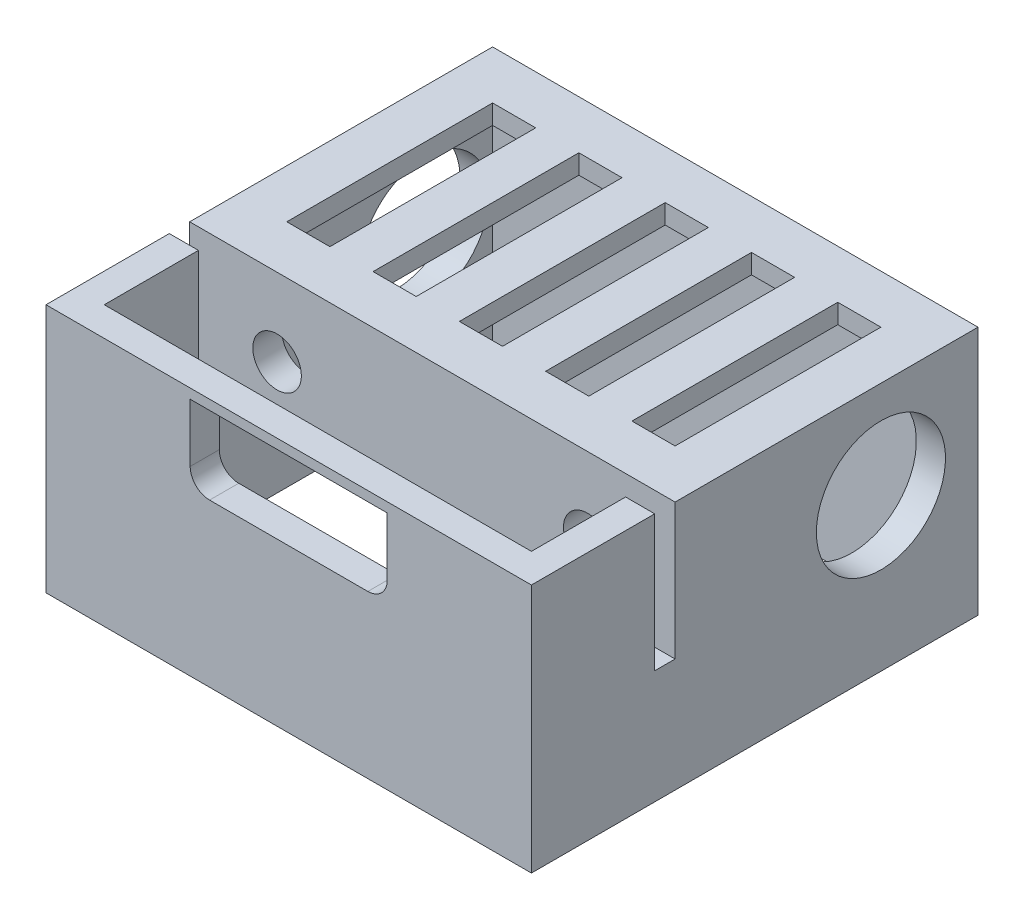
from build123d import *

# Parameters (mm, degrees)
CROQUIS1_W              = 50
CROQUIS1_H              = 46
CROQUIS1_W_2            = 44
CROQUIS1_H_2            = 40
SALIENTE_EXTRUIR1_DEPTH = 15
CROQUIS4_W              = 44
CROQUIS4_H              = 3
SALIENTE_EXTRUIR3_DEPTH = 10.7
CORTAR_EXTRUIR1_REACH   = 72.608
CROQUIS7_W              = 3
CROQUIS7_H              = 10.7
SALIENTE_EXTRUIR4_DEPTH = 10.7
SALIENTE_EXTRUIR5_DEPTH = 10.7
CORTAR_EXTRUIR2_REACH   = 72.778
CROQUIS9_R              = 6.65
CORTAR_EXTRUIR3_REACH   = 70.691
CROQUIS10_R             = 6.65
CROQUIS11_W             = 50
CROQUIS11_H             = 31.2
SALIENTE_EXTRUIR6_DEPTH = 2
CROQUIS12_W             = 3
CROQUIS12_H             = 12
SALIENTE_EXTRUIR7_DEPTH = 44
CORTAR_EXTRUIR4_REACH   = 62.537
CROQUIS13_R             = 2.5
REDONDEO1_R             = 2
CROQUIS15_W             = 2
CROQUIS15_H             = 10.7
SALIENTE_EXTRUIR8_DEPTH = 3
CROQUIS16_W             = 2.1
CROQUIS16_H             = 3.3
CORTAR_EXTRUIR5_DEPTH   = 50
CROQUIS17_W             = 2
CROQUIS17_H             = 10.7
SALIENTE_EXTRUIR9_DEPTH = 3
CORTAR_EXTRUIR6_REACH   = 69.968
CROQUIS18_W             = 4.444444444
CROQUIS18_H             = 21.2


with BuildPart() as part:
    # Croquis1 → Saliente-Extruir1 (new body)
    with BuildSketch(Plane(origin=(0, 0, 0), x_dir=(1, 0, 0), z_dir=(0, 1, 0))):
        with Locations((-22, -20)):
            Rectangle(CROQUIS1_W, CROQUIS1_H)
        with Locations((-22, -20)):
            Rectangle(CROQUIS1_W_2, CROQUIS1_H_2, mode=Mode.SUBTRACT)
    extrude(amount=SALIENTE_EXTRUIR1_DEPTH)

    # Croquis4 → Saliente-Extruir3 (add)
    with BuildSketch(Plane(origin=(0, 15, 0), x_dir=(1, 0, 0), z_dir=(0, 1, 0))):
        with Locations((-22, -41.5)):
            Rectangle(CROQUIS4_W, CROQUIS4_H)
    extrude(amount=SALIENTE_EXTRUIR3_DEPTH)

    # Croquis6 → Cortar-Extruir1 (cut, up to next)
    with BuildSketch(Plane.XY.offset(43), mode=Mode.PRIVATE) as cortar_extruir1_sk1:
        Polygon((-22, 24.7), (-11.85, 24.7), (-11.85, 16.7), (-32.15, 16.7), (-32.15, 24.7), align=None)
    cortar_extruir1_tool1 = extrude(cortar_extruir1_sk1.sketch, amount=-CORTAR_EXTRUIR1_REACH, mode=Mode.PRIVATE) & part.part
    add(cortar_extruir1_tool1.solids().sort_by_distance((-22, 20.7, 43))[0], mode=Mode.SUBTRACT)

    # Croquis7 → Saliente-Extruir4 (add)
    with BuildSketch(Plane.XY.offset(43)):
        with Locations((-45.5, 20.35)):
            Rectangle(CROQUIS7_W, CROQUIS7_H)
        with Locations((1.5, 20.35)):
            Rectangle(CROQUIS7_W, CROQUIS7_H)
    extrude(amount=-SALIENTE_EXTRUIR4_DEPTH)

    # Croquis8 → Saliente-Extruir5 (add)
    with BuildSketch(Plane(origin=(0, 15, 0), x_dir=(1, 0, 0), z_dir=(0, 1, 0))):
        Polygon((-47, -28.2), (-44, -28.2), (-44, 0), (0, 0), (0, -28.2), (3, -28.2), (3, 3), (-47, 3), align=None)
    extrude(amount=SALIENTE_EXTRUIR5_DEPTH)

    # Croquis9 → Cortar-Extruir2 (cut, up to next)
    with BuildSketch(Plane.ZY.offset(47), mode=Mode.PRIVATE) as cortar_extruir2_sk1:
        with Locations((7, 15.7)):
            Circle(CROQUIS9_R)
    cortar_extruir2_tool1 = extrude(cortar_extruir2_sk1.sketch, amount=-CORTAR_EXTRUIR2_REACH, mode=Mode.PRIVATE) & part.part
    add(cortar_extruir2_tool1.solids().sort_by_distance((-47, 15.7, 7))[0], mode=Mode.SUBTRACT)

    # Croquis10 → Cortar-Extruir3 (cut, up to next)
    with BuildSketch(Plane.ZY, mode=Mode.PRIVATE) as cortar_extruir3_sk1:
        with Locations((7, 15.7)):
            Circle(CROQUIS10_R)
    cortar_extruir3_tool1 = extrude(cortar_extruir3_sk1.sketch, amount=-CORTAR_EXTRUIR3_REACH, mode=Mode.PRIVATE) & part.part
    add(cortar_extruir3_tool1.solids().sort_by_distance((0, 15.7, 7))[0], mode=Mode.SUBTRACT)

    # Croquis11 → Saliente-Extruir6 (add)
    with BuildSketch(Plane(origin=(0, 25.7, 0), x_dir=(1, 0, 0), z_dir=(0, 1, 0))):
        with Locations((-22, -12.6)):
            Rectangle(CROQUIS11_W, CROQUIS11_H)
    extrude(amount=-SALIENTE_EXTRUIR6_DEPTH)

    # Croquis12 → Saliente-Extruir7 (add)
    with BuildSketch(Plane.ZY):
        with Locations((26.7, 17.7)):
            Rectangle(CROQUIS12_W, CROQUIS12_H)
    extrude(amount=SALIENTE_EXTRUIR7_DEPTH)

    # Croquis13 → Cortar-Extruir4 (cut, up to next)
    with BuildSketch(Plane(origin=(0, 0, 25.2), x_dir=(-1, 0, 0), z_dir=(0, 0, -1)), mode=Mode.PRIVATE) as cortar_extruir4_sk1:
        with Locations((6, 17.7)):
            Circle(CROQUIS13_R)
    cortar_extruir4_tool1 = extrude(cortar_extruir4_sk1.sketch, amount=-CORTAR_EXTRUIR4_REACH, mode=Mode.PRIVATE) & part.part
    # Croquis13 → Cortar-Extruir4 (cut, up to next)
    with BuildSketch(Plane(origin=(0, 0, 25.2), x_dir=(-1, 0, 0), z_dir=(0, 0, -1)), mode=Mode.PRIVATE) as cortar_extruir4_sk2:
        with Locations((38, 17.7)):
            Circle(CROQUIS13_R)
    cortar_extruir4_tool2 = extrude(cortar_extruir4_sk2.sketch, amount=-CORTAR_EXTRUIR4_REACH, mode=Mode.PRIVATE) & part.part
    add(cortar_extruir4_tool1.solids().sort_by_distance((-6, 17.7, 25.2))[0], mode=Mode.SUBTRACT)
    add(cortar_extruir4_tool2.solids().sort_by_distance((-38, 17.7, 25.2))[0], mode=Mode.SUBTRACT)

    # Redondeo1
    redondeo1_edges = [part.edges().sort_by_distance(p)[0] for p in [
        (-11.85, 16.7, 41.5),
        (-32.15, 16.7, 41.5),
    ]]
    fillet(redondeo1_edges, radius=REDONDEO1_R)

    # Croquis15 → Saliente-Extruir8 (add)
    with BuildSketch(Plane.ZY.offset(47)):
        with Locations((31.3, 20.35)):
            Rectangle(CROQUIS15_W, CROQUIS15_H)
    extrude(amount=-SALIENTE_EXTRUIR8_DEPTH)

    # Croquis16 → Cortar-Extruir5 (cut)
    with BuildSketch(Plane.ZY.offset(47)):
        with Locations((29.25, 13.35)):
            Rectangle(CROQUIS16_W, CROQUIS16_H)
    extrude(amount=-CORTAR_EXTRUIR5_DEPTH, mode=Mode.SUBTRACT)

    # Croquis17 → Saliente-Extruir9 (add)
    with BuildSketch(Plane(origin=(3, 0, 0), x_dir=(0, 0, -1), z_dir=(1, 0, 0))):
        with Locations((-31.3, 20.35)):
            Rectangle(CROQUIS17_W, CROQUIS17_H)
    extrude(amount=-SALIENTE_EXTRUIR9_DEPTH)

    # Croquis18 → Cortar-Extruir6 (cut, up to next)
    with BuildSketch(Plane.XZ.offset(-23.7), mode=Mode.PRIVATE) as cortar_extruir6_sk1:
        with Locations((-39.777777778, 12.6)):
            Rectangle(CROQUIS18_W, CROQUIS18_H)
    cortar_extruir6_tool1 = extrude(cortar_extruir6_sk1.sketch, amount=-CORTAR_EXTRUIR6_REACH, mode=Mode.PRIVATE) & part.part
    # Croquis18 → Cortar-Extruir6 (cut, up to next)
    with BuildSketch(Plane.XZ.offset(-23.7), mode=Mode.PRIVATE) as cortar_extruir6_sk2:
        with Locations((-30.888888889, 12.6)):
            Rectangle(CROQUIS18_W, CROQUIS18_H)
    cortar_extruir6_tool2 = extrude(cortar_extruir6_sk2.sketch, amount=-CORTAR_EXTRUIR6_REACH, mode=Mode.PRIVATE) & part.part
    # Croquis18 → Cortar-Extruir6 (cut, up to next)
    with BuildSketch(Plane.XZ.offset(-23.7), mode=Mode.PRIVATE) as cortar_extruir6_sk3:
        with Locations((-22, 12.6)):
            Rectangle(CROQUIS18_W, CROQUIS18_H)
    cortar_extruir6_tool3 = extrude(cortar_extruir6_sk3.sketch, amount=-CORTAR_EXTRUIR6_REACH, mode=Mode.PRIVATE) & part.part
    # Croquis18 → Cortar-Extruir6 (cut, up to next)
    with BuildSketch(Plane.XZ.offset(-23.7), mode=Mode.PRIVATE) as cortar_extruir6_sk4:
        with Locations((-13.111111111, 12.6)):
            Rectangle(CROQUIS18_W, CROQUIS18_H)
    cortar_extruir6_tool4 = extrude(cortar_extruir6_sk4.sketch, amount=-CORTAR_EXTRUIR6_REACH, mode=Mode.PRIVATE) & part.part
    # Croquis18 → Cortar-Extruir6 (cut, up to next)
    with BuildSketch(Plane.XZ.offset(-23.7), mode=Mode.PRIVATE) as cortar_extruir6_sk5:
        with Locations((-4.222222222, 12.6)):
            Rectangle(CROQUIS18_W, CROQUIS18_H)
    cortar_extruir6_tool5 = extrude(cortar_extruir6_sk5.sketch, amount=-CORTAR_EXTRUIR6_REACH, mode=Mode.PRIVATE) & part.part
    add(cortar_extruir6_tool1.solids().sort_by_distance((-39.777778, 23.7, 12.6))[0], mode=Mode.SUBTRACT)
    add(cortar_extruir6_tool2.solids().sort_by_distance((-30.888889, 23.7, 12.6))[0], mode=Mode.SUBTRACT)
    add(cortar_extruir6_tool3.solids().sort_by_distance((-22, 23.7, 12.6))[0], mode=Mode.SUBTRACT)
    add(cortar_extruir6_tool4.solids().sort_by_distance((-13.111111, 23.7, 12.6))[0], mode=Mode.SUBTRACT)
    add(cortar_extruir6_tool5.solids().sort_by_distance((-4.222222, 23.7, 12.6))[0], mode=Mode.SUBTRACT)


solid = part.part
